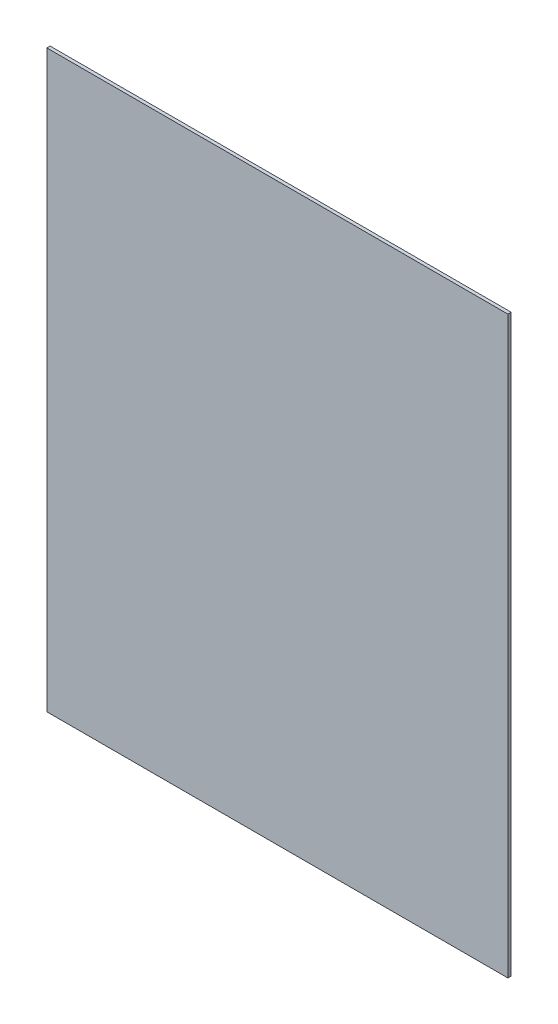
from build123d import *

# Parameters (mm, degrees)
SKETCH1_W           = 448.1322
SKETCH1_H           = 558.8
BOSS_EXTRUDE1_DEPTH = 3.175


with BuildPart() as part:
    # Sketch1 → Boss-Extrude1 (new body)
    with BuildSketch(Plane.XY):
        with Locations((224.0661, 279.4)):
            Rectangle(SKETCH1_W, SKETCH1_H)
    extrude(amount=BOSS_EXTRUDE1_DEPTH)


solid = part.part
